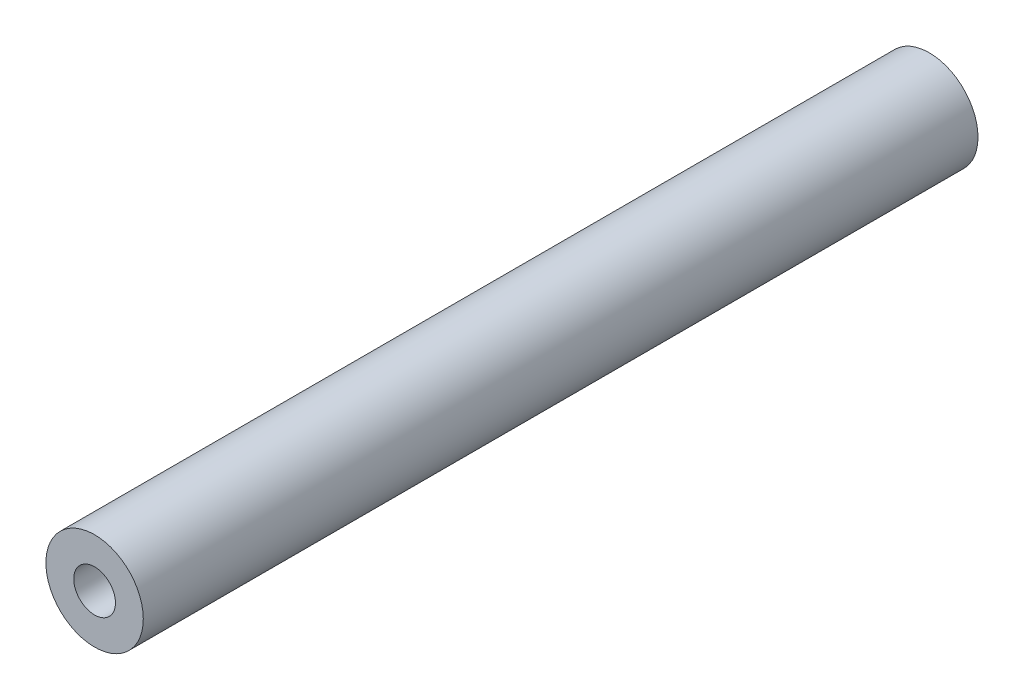
from build123d import *

# Parameters (mm, degrees)
SKETCH1_R           = 7
SKETCH1_R_2         = 3
BOSS_EXTRUDE1_DEPTH = 60


with BuildPart() as part:
    # Sketch1 → Boss-Extrude1 (new, symmetric)
    with BuildSketch(Plane(origin=(0, 0, 0), x_dir=(0, 1, 0), z_dir=(0, 0, 1))):
        with Locations(Location((0, 0, 0), (0, 0, 270))):
            Circle(SKETCH1_R)
        with Locations(Location((0, 0, 0), (0, 0, 270))):
            Circle(SKETCH1_R_2, mode=Mode.SUBTRACT)
    extrude(amount=BOSS_EXTRUDE1_DEPTH, both=True)


solid = part.part
